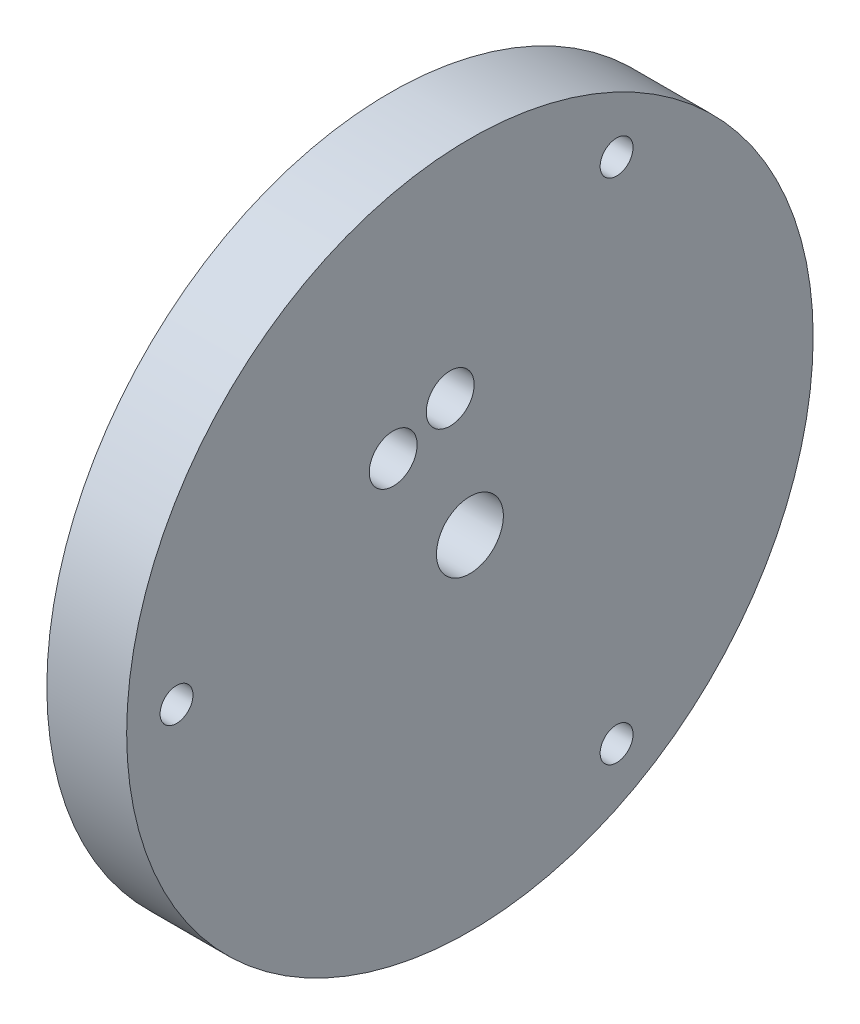
from build123d import *

# Parameters (mm, degrees)
AXIAL_PROFILE_MM_W     = 8
AXIAL_PROFILE_MM_H     = 31.05
AXIAL_HOLES_DEPTH      = 165.078060691
AXIAL_HOLES_DEPTH_BACK = 165.078060691
SKETCH2_R              = 2.4
SKETCH2_R_2            = 1.65
CUT_EXTRUDE2_START     = 148.7
SKETCH3_R              = 1.65
CUT_EXTRUDE2_DEPTH     = 6


with BuildPart() as part:
    # Axial profile (mm) → Full revolution (revolve)
    with BuildSketch(Plane.XY, mode=Mode.PRIVATE) as full_revolution_sk:
        with Locations((152.7, 18.875)):
            Rectangle(AXIAL_PROFILE_MM_W, AXIAL_PROFILE_MM_H)
    revolve(full_revolution_sk.sketch.rotate(Axis((-110, 0, 0), (1, 0, 0)), 90), axis=Axis((-110, 0, 0), (1, 0, 0)))

    # Sketch2 → Axial holes (cut, two sides: drawn at the far end of the back side and taken through both)
    with BuildSketch(Plane(origin=(0, 0, 0), x_dir=(0, 0, -1), z_dir=(1, 0, 0)).offset(-AXIAL_HOLES_DEPTH_BACK)):
        with Locations((-1.977382665, 12.848733704)):
            Circle(SKETCH2_R)
        with Locations((-7.687206041, 10.483647423)):
            Circle(SKETCH2_R)
        with Locations((-29.4, 0)):
            Circle(SKETCH2_R_2)
        with Locations((14.7, -25.461146871)):
            Circle(SKETCH2_R_2)
        with Locations((14.7, 25.461146871)):
            Circle(SKETCH2_R_2)
    extrude(amount=AXIAL_HOLES_DEPTH + AXIAL_HOLES_DEPTH_BACK, mode=Mode.SUBTRACT)

    # Sketch3 → Cut-Extrude2 (cut)
    with BuildSketch(Plane(origin=(0, 0, 0), x_dir=(0, 0, -1), z_dir=(1, 0, 0)).offset(CUT_EXTRUDE2_START)):
        with Locations((-12, 0)):
            Circle(SKETCH3_R)
        with Locations((6, -10.392304845)):
            Circle(SKETCH3_R)
        with Locations((6, 10.392304845)):
            Circle(SKETCH3_R)
    extrude(amount=CUT_EXTRUDE2_DEPTH, mode=Mode.SUBTRACT)


solid = part.part
